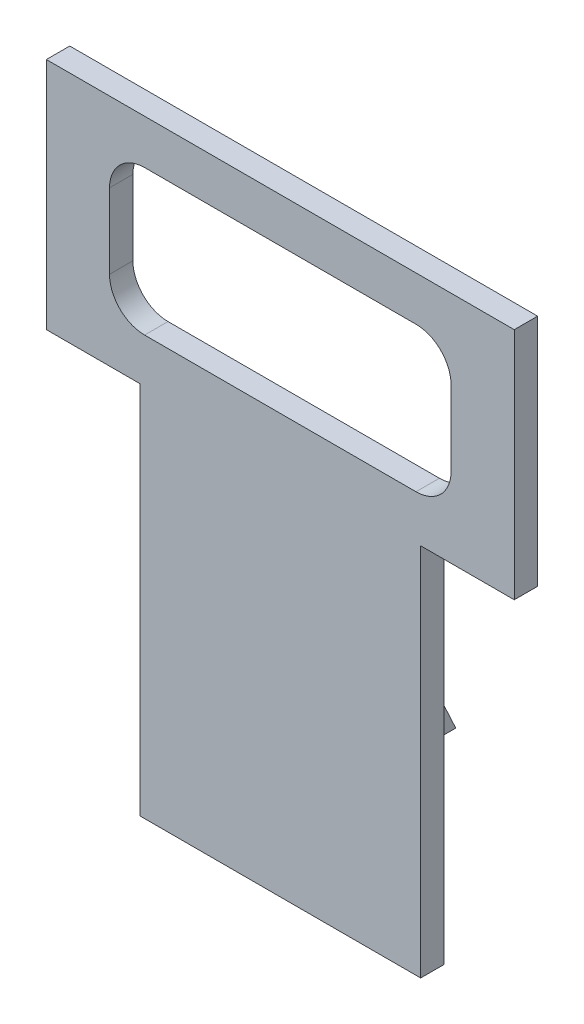
from build123d import *

# Parameters (mm, degrees)
SKETCH1_W           = 100
SKETCH1_H           = 50
BOSS_EXTRUDE1_DEPTH = 5
CUT_EXTRUDE1_DEPTH  = 5
SKETCH3_W           = 60
SKETCH3_H           = 5
BOSS_EXTRUDE2_DEPTH = 80
SKETCH6_W           = 5
SKETCH6_H           = 65
BOSS_EXTRUDE4_DEPTH = 30
CUT_EXTRUDE3_DEPTH  = 5


with BuildPart() as part:
    # Sketch1 → Boss-Extrude1 (new body)
    with BuildSketch(Plane.XY):
        with Locations((50, 25)):
            Rectangle(SKETCH1_W, SKETCH1_H)
    extrude(amount=BOSS_EXTRUDE1_DEPTH)

    # Sketch2 → Cut-Extrude1 (cut)
    with BuildSketch(Plane.XY.offset(5)):
        with BuildLine():
            Line((21, 40.5), (79, 40.5))
            ThreePointArc((79, 40.5), (84.303300859, 38.303300859), (86.5, 33))
            Line((86.5, 33), (86.5, 17))
            ThreePointArc((86.5, 17), (84.303300859, 11.696699141), (79, 9.5))
            Line((79, 9.5), (21, 9.5))
            ThreePointArc((21, 9.5), (15.696699141, 11.696699141), (13.5, 17))
            Line((13.5, 17), (13.5, 33))
            ThreePointArc((13.5, 33), (15.696699141, 38.303300859), (21, 40.5))
        make_face()
    extrude(amount=-CUT_EXTRUDE1_DEPTH, mode=Mode.SUBTRACT)

    # Sketch3 → Boss-Extrude2 (add)
    with BuildSketch(Plane.XZ):
        with Locations((50, 2.5)):
            Rectangle(SKETCH3_W, SKETCH3_H)
    extrude(amount=BOSS_EXTRUDE2_DEPTH)

    # Sketch6 → Boss-Extrude4 (add)
    with BuildSketch(Plane(origin=(0, 0, 0), x_dir=(-1, 0, 0), z_dir=(0, 0, -1))):
        with Locations((-50, -32.5)):
            Rectangle(SKETCH6_W, SKETCH6_H)
    extrude(amount=BOSS_EXTRUDE4_DEPTH)

    # Sketch7 → Cut-Extrude3 (cut)
    with BuildSketch(Plane(origin=(52.5, 0, 0), x_dir=(0, 0, -1), z_dir=(1, 0, 0))):
        Polygon((0, 0), (30, -65), (30, 0), align=None)
    extrude(amount=-CUT_EXTRUDE3_DEPTH, mode=Mode.SUBTRACT)


solid = part.part
